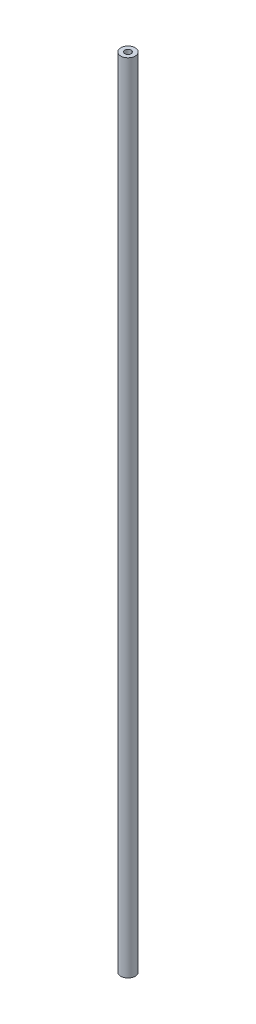
from build123d import *

# Parameters (mm, degrees)
SKETCH1_R           = 0.25
SKETCH1_R_2         = 0.11
BOSS_EXTRUDE1_DEPTH = 27.57


with BuildPart() as part:
    # Sketch1 → Boss-Extrude1 (new body)
    with BuildSketch(Plane(origin=(0, 0, 0), x_dir=(1, 0, 0), z_dir=(0, 1, 0))):
        with Locations(Location((0, 0, 0), (0, 0, 270))):
            Circle(SKETCH1_R)
        with Locations(Location((0, 0, 0), (0, 0, 270))):
            Circle(SKETCH1_R_2, mode=Mode.SUBTRACT)
    extrude(amount=BOSS_EXTRUDE1_DEPTH)


solid = part.part
